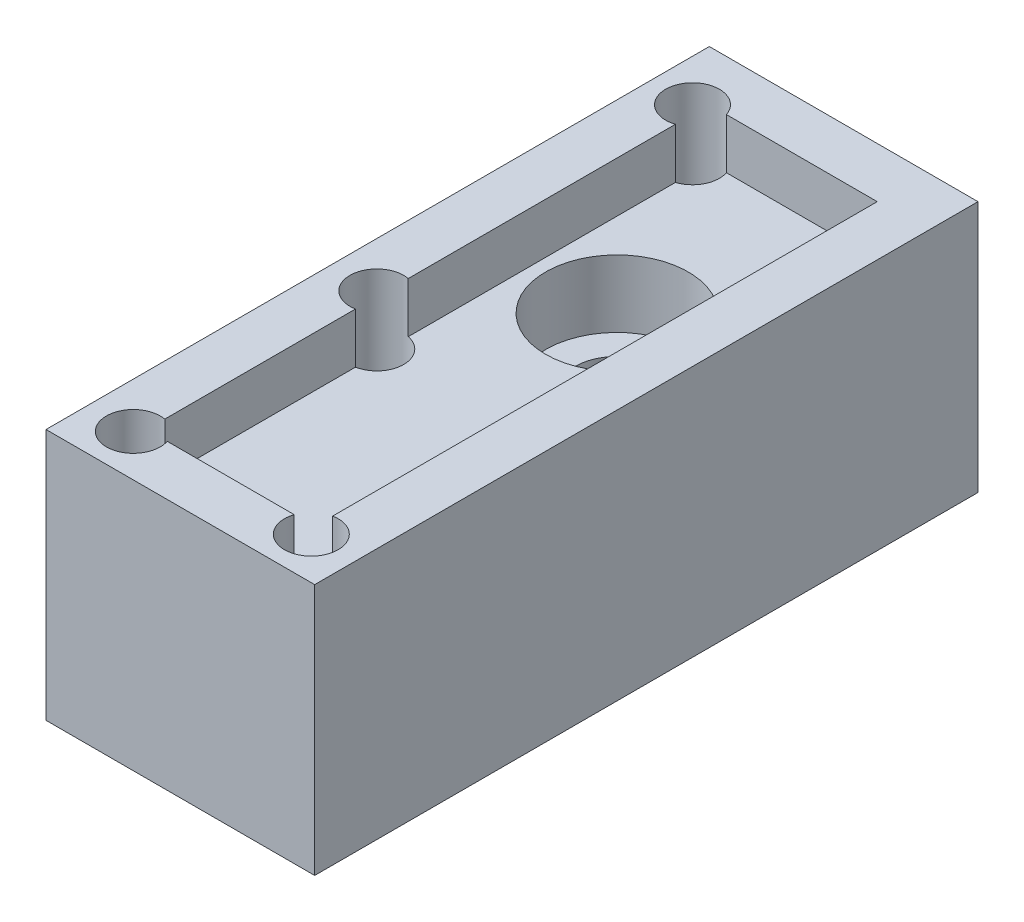
from build123d import *

# Parameters (mm, degrees)
SKETCH1_W               = 16
SKETCH1_H               = 39.5
BOSS_EXTRUDE1_DEPTH     = 15
SKETCH2_W               = 10
SKETCH2_H               = 33.5
CUT_EXTRUDE1_DEPTH      = 3
CUT_EXTRUDE2_DEPTH      = 45.274710615
CUT_EXTRUDE2_DEPTH_BACK = 45.274710615
SKETCH3_R               = 1.6
CUT_EXTRUDE3_DEPTH      = 3
CUT_EXTRUDE3_DEPTH_BACK = 46.180194776
SKETCH4_R               = 1.6
SKETCH5_R               = 2.5
CUT_EXTRUDE4_DEPTH      = 20
SKETCH8_R               = 4.25
CUT_EXTRUDE5_DEPTH      = 4


with BuildPart() as part:
    # Sketch1 → Boss-Extrude1 (new body)
    with BuildSketch(Plane(origin=(0, 0, 0), x_dir=(1, 0, 0), z_dir=(0, 1, 0))):
        with Locations((8, 19.75)):
            Rectangle(SKETCH1_W, SKETCH1_H)
    extrude(amount=BOSS_EXTRUDE1_DEPTH)

    # Sketch2 → Cut-Extrude1 (cut)
    with BuildSketch(Plane(origin=(0, 15, 0), x_dir=(1, 0, 0), z_dir=(0, 1, 0))):
        with Locations((8, 19.75)):
            Rectangle(SKETCH2_W, SKETCH2_H)
    extrude(amount=-CUT_EXTRUDE1_DEPTH, mode=Mode.SUBTRACT)

    # Sketch3 → Cut-Extrude2 (cut, two sides: drawn at the far end of the back side and taken through both)
    with BuildSketch(Plane(origin=(0, 12, 0), x_dir=(1, 0, 0), z_dir=(0, 1, 0)).offset(-CUT_EXTRUDE2_DEPTH_BACK)):
        with Locations((2.7, 2.5)):
            Circle(SKETCH3_R)
    extrude(amount=CUT_EXTRUDE2_DEPTH + CUT_EXTRUDE2_DEPTH_BACK, mode=Mode.SUBTRACT)

    # Sketch4 → Cut-Extrude3 (cut, two sides: drawn at the far end of the back side and taken through both)
    with BuildSketch(Plane(origin=(0, 15, 0), x_dir=(1, 0, 0), z_dir=(0, 1, 0)).offset(-CUT_EXTRUDE3_DEPTH_BACK)):
        with Locations((13.3, 2.5)):
            Circle(SKETCH4_R)
        with Locations((2.7, 17)):
            Circle(SKETCH4_R)
        with Locations((2.5, 36)):
            Circle(SKETCH4_R)
    extrude(amount=CUT_EXTRUDE3_DEPTH + CUT_EXTRUDE3_DEPTH_BACK, mode=Mode.SUBTRACT)

    # Sketch5 → Cut-Extrude4 (cut)
    with BuildSketch(Plane(origin=(0, 12, 0), x_dir=(1, 0, 0), z_dir=(0, 1, 0))):
        with Locations((8, 26)):
            Circle(SKETCH5_R)
    extrude(amount=-CUT_EXTRUDE4_DEPTH, mode=Mode.SUBTRACT)

    # Sketch8 → Cut-Extrude5 (cut)
    with BuildSketch(Plane(origin=(0, 12, 0), x_dir=(1, 0, 0), z_dir=(0, 1, 0))):
        with Locations((8, 26)):
            Circle(SKETCH8_R)
    extrude(amount=-CUT_EXTRUDE5_DEPTH, mode=Mode.SUBTRACT)


solid = part.part
